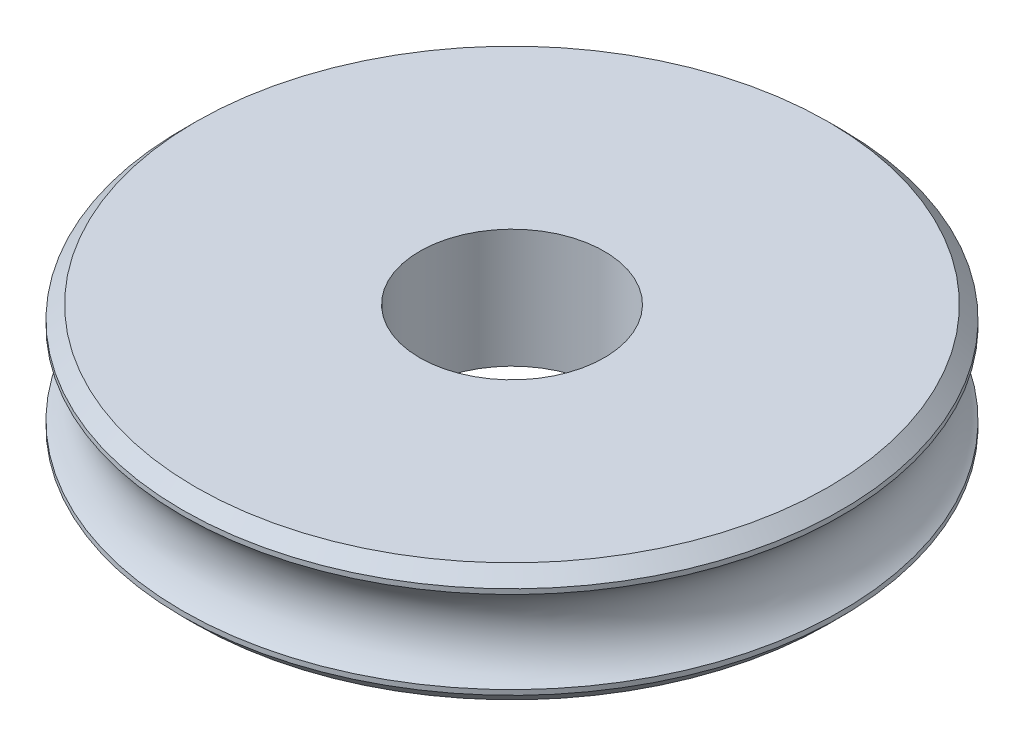
from build123d import *


with BuildPart() as part:
    # Sketch2 → Revolve2 (revolve)
    with BuildSketch(Plane.XY, mode=Mode.PRIVATE) as revolve2_sk:
        with BuildLine():
            Line((3.5, 2.25), (3.5, -2.25))
            Line((3.5, -2.25), (12, -2.25))
            Line((12, -2.25), (12.5, -1.75))
            Line((12.5, -1.75), (12.5, -1.5612495))
            ThreePointArc((12.5, -1.5612495), (11.75, 0), (12.5, 1.5612495))
            Line((12.5, 1.5612495), (12.5, 1.75))
            Line((12.5, 1.75), (12, 2.25))
            Line((12, 2.25), (3.5, 2.25))
        make_face()
    revolve(revolve2_sk.sketch.rotate(Axis((0, 0, 0), (0, -1, 0)), 90), axis=Axis((0, 0, 0), (0, -1, 0)))


solid = part.part
